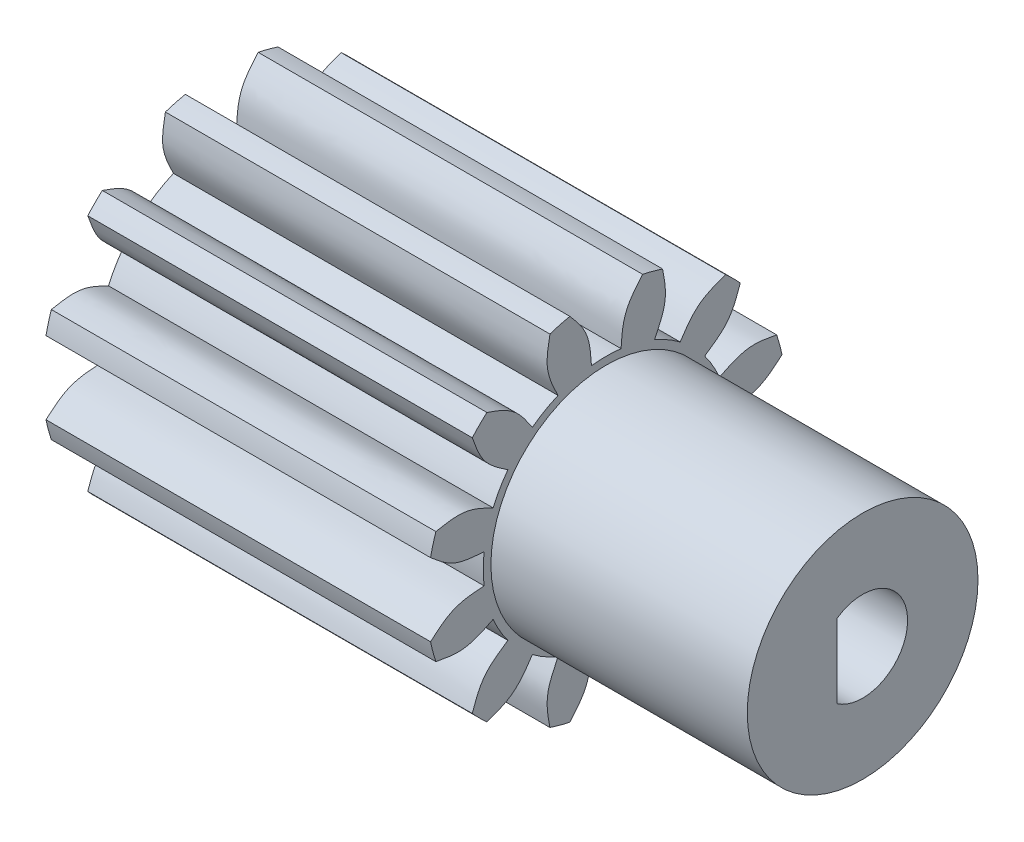
from build123d import *

# Parameters (mm, degrees)
KUGGLUCKA_DEPTH     = 15
CIRPATTERN_COUNT    = 12
SKETCH1_R           = 1.754
CUT_EXTRUDE1_DEPTH  = 10
BOSS_EXTRUDE1_DEPTH = 10


with BuildPart() as part:
    # Ritning 1 → Kugghjulsämne (revolve)
    with BuildSketch(Plane.XY, mode=Mode.PRIVATE) as kugghjuls_mne_sk:
        Polygon((12.5, 1), (2.5, 1), (2.5, 3.5), (-12.5, 3.5), (-12.5, -3.5), (12.5, -3.5), align=None)
    revolve(kugghjuls_mne_sk.sketch.rotate(Axis((-12.5, -3.5, 0), (1, 0, 0)), 90), axis=Axis((-12.5, -3.5, 0), (1, 0, 0)))

    # Ritning 2 → Kugglucka (cut)
    with BuildSketch(Plane.ZY.offset(12.5)):
        with BuildLine():
            Line((1.419865071, 3.354486354), (0, 4.774351425))
            Line((0, 4.774351425), (-1.419865071, 3.354486354))
            add(Edge.make_bspline(
                [(-1.419865071, 3.354486354), (-1.173032372, 3.067088657), (-0.658113481, 2.467546927), (-0.604624671, 1.6768746), (-0.576776379, 1.265220772)],
                knots=[0, 0, 0, 0, 0.479362292, 1, 1, 1, 1], degree=3))
            ThreePointArc((-0.576776379, 1.265220772), (0, 1.3), (0.576776379, 1.265220772))
            add(Edge.make_bspline(
                [(1.419865071, 3.354486354), (1.173032372, 3.067088657), (0.658113481, 2.467546927), (0.604624671, 1.6768746), (0.576776379, 1.265220772)],
                knots=[0, 0, 0, 0, 0.479362292, 1, 1, 1, 1], degree=3))
        make_face()
    kugglucka = extrude(amount=-KUGGLUCKA_DEPTH, mode=Mode.SUBTRACT)

    # CirPattern: Kugglucka ×12 about axis
    cirpattern_axis = Axis((-12.5, -3.5, 0), (-1, 0, 0))
    for i in range(1, CIRPATTERN_COUNT):
        add(kugglucka.rotate(cirpattern_axis, i * 360 / CIRPATTERN_COUNT), mode=Mode.SUBTRACT)

    # Sketch1 → Cut-Extrude1 (cut)
    with BuildSketch(Plane(origin=(12.5, 0, 0), x_dir=(0, 0, -1), z_dir=(1, 0, 0))):
        with Locations((0, -3.5)):
            Circle(SKETCH1_R)
    extrude(amount=-CUT_EXTRUDE1_DEPTH, mode=Mode.SUBTRACT)

    # Sketch3 → Boss-Extrude1 (add)
    with BuildSketch(Plane(origin=(12.5, 0, 0), x_dir=(0, 0, -1), z_dir=(1, 0, 0))):
        Polygon((-1, -1.322696024), (-1, -6.208852365), (-3.330635242, -3.367112903), align=None)
    extrude(amount=-BOSS_EXTRUDE1_DEPTH)


solid = part.part
